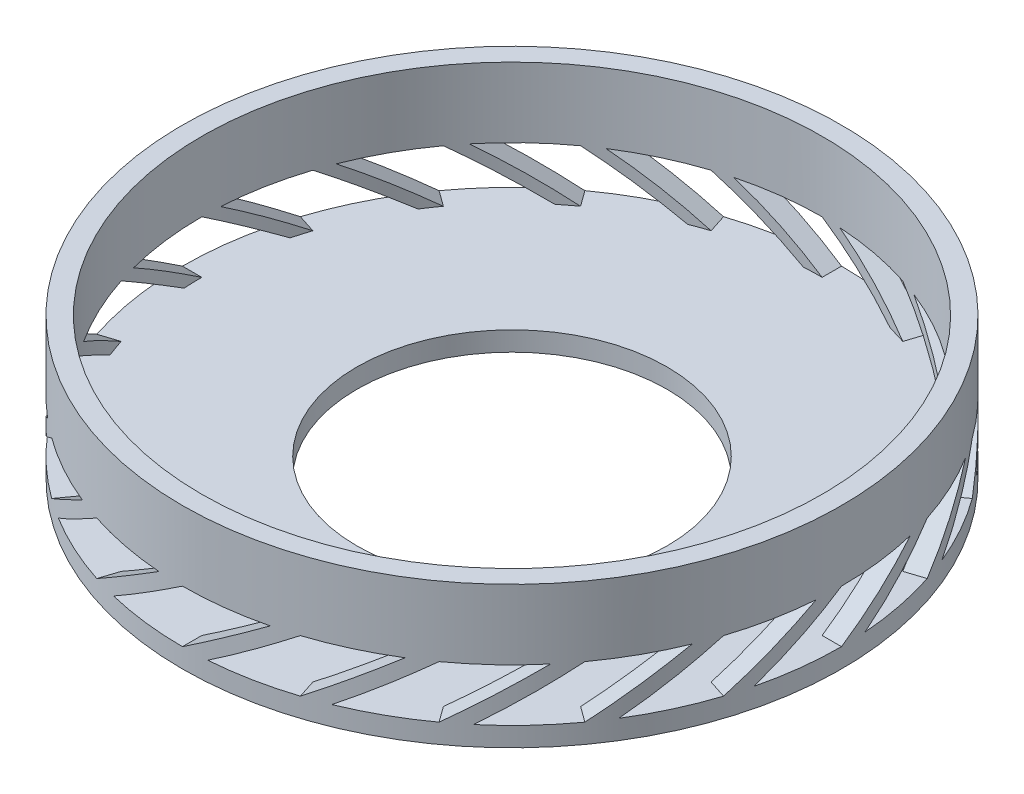
from build123d import *

# Parameters (mm, degrees)
SKETCH2_R               = 26.9875
BOSS_EXTRUDE1_DEPTH     = 11.5951
SHELL1_T                = -1.5875
CUT_EXTRUDE1_DEPTH      = 40.456334983
CUT_EXTRUDE1_DEPTH_BACK = 40.456334983
SKETCH5_R               = 12.7
CUT_EXTRUDE2_DEPTH      = 38.1
CIRPATTERN3_COUNT       = 20


with BuildPart() as part:
    # Sketch2 → Boss-Extrude1 (new body)
    with BuildSketch(Plane(origin=(0, 0, 0), x_dir=(1, 0, 0), z_dir=(0, 1, 0))):
        Circle(SKETCH2_R)
    extrude(amount=BOSS_EXTRUDE1_DEPTH)

    # Shell1
    shell1_openings = [part.faces().sort_by_distance(p)[0] for p in [
        (0, 11.5951, 0),
    ]]
    offset(amount=SHELL1_T, openings=shell1_openings, kind=Kind.INTERSECTION)

    # Sketch5 → Cut-Extrude1 (cut, two sides: drawn at the far end of the back side and taken through both)
    with BuildSketch(Plane(origin=(0, 1.5875, 0), x_dir=(1, 0, 0), z_dir=(0, 1, 0)).offset(-CUT_EXTRUDE1_DEPTH_BACK)):
        Circle(SKETCH5_R)
    extrude(amount=CUT_EXTRUDE1_DEPTH + CUT_EXTRUDE1_DEPTH_BACK, mode=Mode.SUBTRACT)

    # Sketch6 → Cut-Extrude2 (cut)
    with BuildSketch(Plane.XY):
        Polygon((6.413577678, 1.5875), (0, 5.8801), (-6.413577678, 5.8801), (0, 1.5875), align=None)
    cut_extrude2 = extrude(amount=-CUT_EXTRUDE2_DEPTH, mode=Mode.SUBTRACT)

    # CirPattern3: Cut-Extrude2 ×20 about axis
    cirpattern3_axis = Axis((0, 11.5951, 0), (0, -1, 0))
    for i in range(1, CIRPATTERN3_COUNT):
        add(cut_extrude2.rotate(cirpattern3_axis, i * 360 / CIRPATTERN3_COUNT), mode=Mode.SUBTRACT)


solid = part.part
